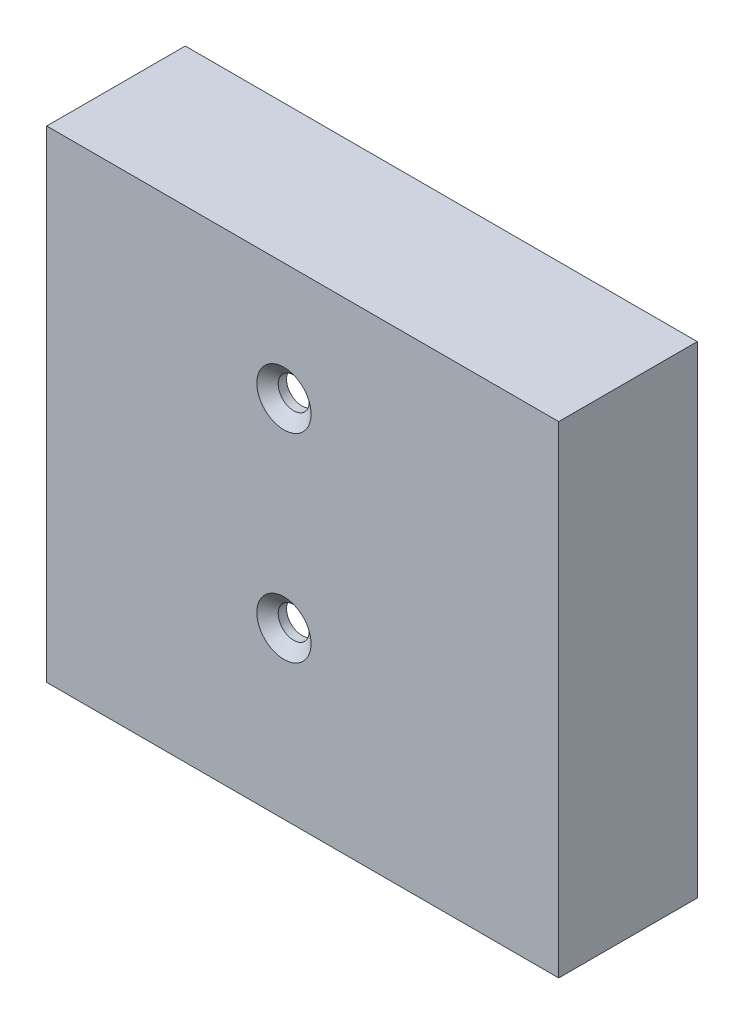
from build123d import *

# Parameters (mm, degrees)
SKETCH1_W                                         = 52.3875
SKETCH1_H                                         = 50.8
BOSS_EXTRUDE1_DEPTH                               = 1.905
SKETCH2_W                                         = 14.605
SKETCH2_H                                         = 50.8
BOSS_EXTRUDE2_DEPTH                               = 1.5875
BOSS_EXTRUDE3_DEPTH                               = 12.7
CUT_EXTRUDE1_REACH                                = 76.07
SKETCH4_W                                         = 10.16
SKETCH4_H                                         = 3.8608
CUT_EXTRUDE2_REACH                                = 76.07
SKETCH5_W                                         = 6.985
SKETCH5_H                                         = 12.7
SKETCH5_W_2                                       = 7.112
SKETCH6_W                                         = 10.16
SKETCH6_H                                         = 2.54
BOSS_EXTRUDE4_DEPTH                               = 8.8392
SKETCH8_W                                         = 1.27
SKETCH8_H                                         = 41.402
BOSS_EXTRUDE5_DEPTH                               = 14.2875
BOSS_EXTRUDE6_DEPTH                               = 1.5875
CUT_EXTRUDE3_REACH                                = 75.47
SKETCH11_W                                        = 1.5875
SKETCH11_H                                        = 5.08
CSK_FOR_4_FLAT_HEAD_MACHINE_SCREW_100_D           = 3.2639
CSK_FOR_4_FLAT_HEAD_MACHINE_SCREW_100_DEPTH       = 7.493
CSK_FOR_4_FLAT_HEAD_MACHINE_SCREW_100_CSINK_D     = 5.715
CSK_FOR_4_FLAT_HEAD_MACHINE_SCREW_100_CSINK_ANGLE = 100
CSK_FOR_4_FLAT_HEAD_MACHINE_SCREW_100_TIP         = 0.980574487


with BuildPart() as part:
    # Sketch1 → Boss-Extrude1 (new body)
    with BuildSketch(Plane.XY):
        with Locations((26.19375, 25.4)):
            Rectangle(SKETCH1_W, SKETCH1_H)
    extrude(amount=BOSS_EXTRUDE1_DEPTH)

    # Sketch2 → Boss-Extrude2 (add)
    with BuildSketch(Plane.ZY):
        with Locations((-5.3975, 25.4)):
            Rectangle(SKETCH2_W, SKETCH2_H)
    extrude(amount=BOSS_EXTRUDE2_DEPTH)

    # Sketch3 → Boss-Extrude3 (add)
    with BuildSketch(Plane(origin=(0, 0, 0), x_dir=(-1, 0, 0), z_dir=(0, 0, -1))):
        Polygon((0, 50.8), (-52.3875, 50.8), (-52.3875, 0), (0, 0), (0, 2.54), (-49.8475, 2.54), (-49.8475, 48.26), (0, 48.26), align=None)
    extrude(amount=BOSS_EXTRUDE3_DEPTH)

    # Sketch4 → Cut-Extrude1 (cut, up to next)
    with BuildSketch(Plane.XZ, mode=Mode.PRIVATE) as cut_extrude1_sk1:
        with Locations((12.065, -10.7696)):
            Rectangle(SKETCH4_W, SKETCH4_H)
    cut_extrude1_tool1 = extrude(cut_extrude1_sk1.sketch, amount=-CUT_EXTRUDE1_REACH, mode=Mode.PRIVATE) & part.part
    add(cut_extrude1_tool1.solids().sort_by_distance((12.065, 0, -10.7696))[0], mode=Mode.SUBTRACT)

    # Sketch5 → Cut-Extrude2 (cut, up to next)
    with BuildSketch(Plane.XZ, mode=Mode.PRIVATE) as cut_extrude2_sk1:
        with Locations((3.4925, -6.35)):
            Rectangle(SKETCH5_W, SKETCH5_H)
    cut_extrude2_tool1 = extrude(cut_extrude2_sk1.sketch, amount=-CUT_EXTRUDE2_REACH, mode=Mode.PRIVATE) & part.part
    # Sketch5 → Cut-Extrude2 (cut, up to next)
    with BuildSketch(Plane.XZ, mode=Mode.PRIVATE) as cut_extrude2_sk2:
        with Locations((20.701, -6.35)):
            Rectangle(SKETCH5_W_2, SKETCH5_H)
    cut_extrude2_tool2 = extrude(cut_extrude2_sk2.sketch, amount=-CUT_EXTRUDE2_REACH, mode=Mode.PRIVATE) & part.part
    add(cut_extrude2_tool1.solids().sort_by_distance((3.4925, 0, -6.35))[0], mode=Mode.SUBTRACT)
    add(cut_extrude2_tool2.solids().sort_by_distance((20.701, 0, -6.35))[0], mode=Mode.SUBTRACT)

    # Sketch6 → Boss-Extrude4 (add)
    with BuildSketch(Plane(origin=(0, 0, 0), x_dir=(-1, 0, 0), z_dir=(0, 0, -1))):
        with Locations((-12.065, 3.81)):
            Rectangle(SKETCH6_W, SKETCH6_H)
    extrude(amount=BOSS_EXTRUDE4_DEPTH)

    # Sketch8 → Boss-Extrude5 (add)
    with BuildSketch(Plane(origin=(0, 0, 0), x_dir=(-1, 0, 0), z_dir=(0, 0, -1))):
        with Locations((-0.635, 27.559)):
            Rectangle(SKETCH8_W, SKETCH8_H)
    extrude(amount=BOSS_EXTRUDE5_DEPTH)

    # Sketch9 → Boss-Extrude6 (add)
    with BuildSketch(Plane(origin=(0, 0, -12.7), x_dir=(-1, 0, 0), z_dir=(0, 0, -1))):
        Polygon((0, 48.26), (0, 48.895), (-50.4825, 48.895), (-50.4825, 1.905), (-24.257, 1.905), (-24.257, 2.54), (-49.8475, 2.54), (-49.8475, 48.26), align=None)
    extrude(amount=BOSS_EXTRUDE6_DEPTH)

    # Sketch11 → Cut-Extrude3 (cut, up to next)
    with BuildSketch(Plane(origin=(1.27, 0, 0), x_dir=(0, 0, -1), z_dir=(1, 0, 0)), mode=Mode.PRIVATE) as cut_extrude3_sk1:
        with Locations((13.49375, 25.4)):
            Rectangle(SKETCH11_W, SKETCH11_H)
    cut_extrude3_tool1 = extrude(cut_extrude3_sk1.sketch, amount=-CUT_EXTRUDE3_REACH, mode=Mode.PRIVATE) & part.part
    # Sketch11 → Cut-Extrude3 (cut, up to next)
    with BuildSketch(Plane(origin=(1.27, 0, 0), x_dir=(0, 0, -1), z_dir=(1, 0, 0)), mode=Mode.PRIVATE) as cut_extrude3_sk2:
        with Locations((13.49375, 12.065)):
            Rectangle(SKETCH11_W, SKETCH11_H)
    cut_extrude3_tool2 = extrude(cut_extrude3_sk2.sketch, amount=-CUT_EXTRUDE3_REACH, mode=Mode.PRIVATE) & part.part
    # Sketch11 → Cut-Extrude3 (cut, up to next)
    with BuildSketch(Plane(origin=(1.27, 0, 0), x_dir=(0, 0, -1), z_dir=(1, 0, 0)), mode=Mode.PRIVATE) as cut_extrude3_sk3:
        with Locations((13.49375, 46.355)):
            Rectangle(SKETCH11_W, SKETCH11_H)
    cut_extrude3_tool3 = extrude(cut_extrude3_sk3.sketch, amount=-CUT_EXTRUDE3_REACH, mode=Mode.PRIVATE) & part.part
    add(cut_extrude3_tool1.solids().sort_by_distance((1.27, 25.4, -13.49375))[0], mode=Mode.SUBTRACT)
    add(cut_extrude3_tool2.solids().sort_by_distance((1.27, 12.065, -13.49375))[0], mode=Mode.SUBTRACT)
    add(cut_extrude3_tool3.solids().sort_by_distance((1.27, 46.355, -13.49375))[0], mode=Mode.SUBTRACT)

    # CSK for #4 Flat Head Machine Screw (100)1
    with Locations(Plane.XY.offset(1.905)):
        with Locations((23.4188, 38.4175), (23.4188, 17.4625)):
            CounterSinkHole(CSK_FOR_4_FLAT_HEAD_MACHINE_SCREW_100_D / 2, CSK_FOR_4_FLAT_HEAD_MACHINE_SCREW_100_CSINK_D / 2, depth=CSK_FOR_4_FLAT_HEAD_MACHINE_SCREW_100_DEPTH, counter_sink_angle=CSK_FOR_4_FLAT_HEAD_MACHINE_SCREW_100_CSINK_ANGLE)
            with Locations((0, 0, -(CSK_FOR_4_FLAT_HEAD_MACHINE_SCREW_100_DEPTH + CSK_FOR_4_FLAT_HEAD_MACHINE_SCREW_100_TIP / 2))):  # 118° drill point
                Cone(0, CSK_FOR_4_FLAT_HEAD_MACHINE_SCREW_100_D / 2, CSK_FOR_4_FLAT_HEAD_MACHINE_SCREW_100_TIP, mode=Mode.SUBTRACT)


solid = part.part
